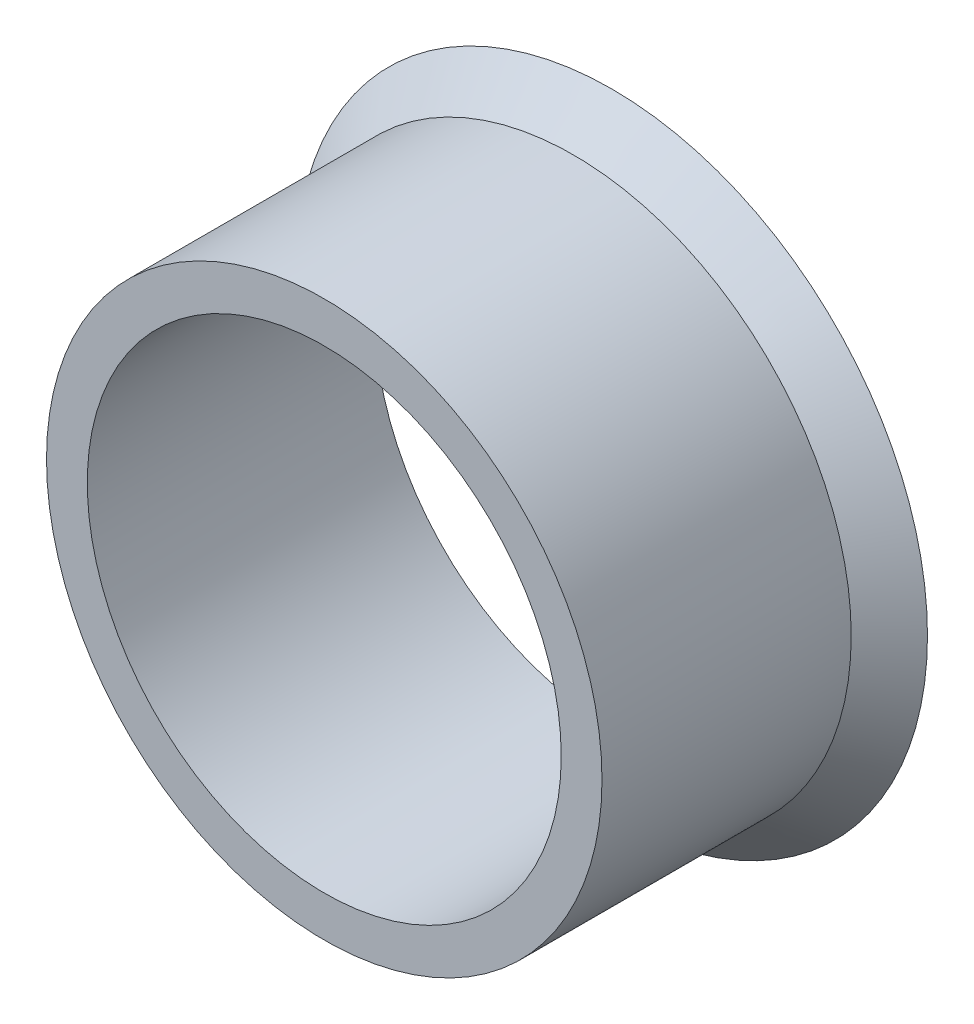
from build123d import *

# Parameters (mm, degrees)
IZIM1_R                     = 27.1
Y_KSEKLIK_EKSTR_ZYON1_DEPTH = 3.3
IZIM3_R                     = 23.85
Y_KSEKLIK_EKSTR_ZYON2_DEPTH = 21.4
IZIM6_R                     = 20.35
KES_EKSTR_ZYON1_DEPTH       = 50


with BuildPart() as part:
    # Çizim1 → Yükseklik-Ekstrüzyon1 (new body)
    with BuildSketch(Plane.XY):
        Circle(IZIM1_R)
    extrude(amount=Y_KSEKLIK_EKSTR_ZYON1_DEPTH)

    # Çizim3 → Yükseklik-Ekstrüzyon2 (add)
    with BuildSketch(Plane.XY.offset(3.3)):
        Circle(IZIM3_R)
    extrude(amount=Y_KSEKLIK_EKSTR_ZYON2_DEPTH)

    # loft up to a face of the part (loft1)
    loft([Face(Wire([part.edges().sort_by_distance((-18.551226571, -19.755049803, 0))[0]])), Face(Wire([part.edges().sort_by_distance((-16.326448476, 17.385901764, 3.3))[0]]))])

    # Çizim5 → Kes-Döndür1 (revolve, cut)
    with BuildSketch(Plane(origin=(0, 0, 0), x_dir=(1, 0, 0), z_dir=(0, 1, 0))):
        Polygon((-27.1, 0), (-23.85, -3.3), (-27.1, -3.3), align=None)
    revolve(axis=Axis((0, 0, -4.734059464), (0, 0, 1)), mode=Mode.SUBTRACT)

    # Çizim6 → Kes-Ekstrüzyon1 (cut)
    with BuildSketch(Plane.XY.offset(24.7)):
        Circle(IZIM6_R)
    extrude(amount=-KES_EKSTR_ZYON1_DEPTH, mode=Mode.SUBTRACT)


solid = part.part
